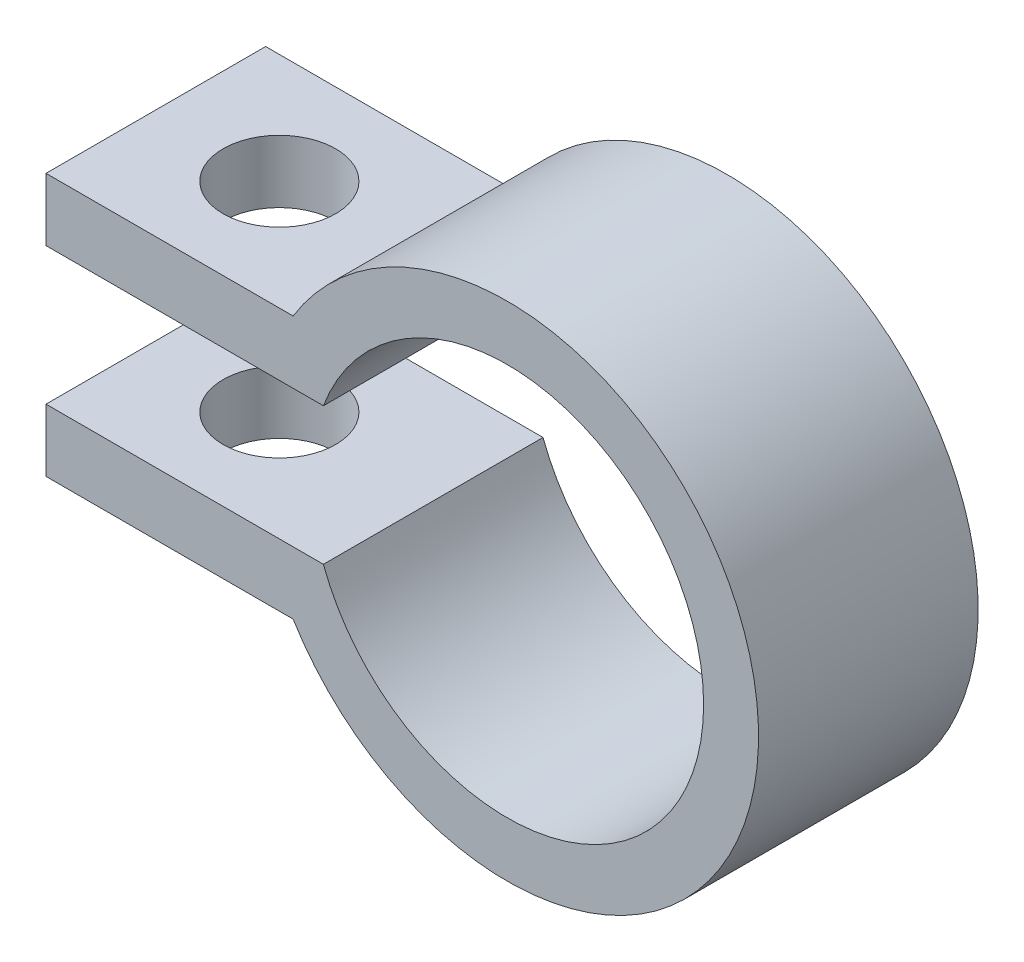
from build123d import *

# Parameters (mm, degrees)
BOSS_EXTRUDE1_DEPTH = 8
SKETCH3_R           = 2.05
CUT_EXTRUDE1_DEPTH  = 18.5


with BuildPart() as part:
    # Sketch1 → Boss-Extrude1 (new body)
    with BuildSketch(Plane.XY):
        with BuildLine():
            Line((-16.801846397, -4.780553608), (-7.801846397, -4.780553608))
            ThreePointArc((-7.801846397, -4.780553608), (9.15, 0), (-7.801846397, 4.780553608))
            Line((-7.801846397, 4.780553608), (-16.801846397, 4.780553608))
            Line((-16.801846397, 4.780553608), (-16.801846397, 2.5))
            Line((-16.801846397, 2.5), (-8.801846397, 2.5))
            Line((-8.801846397, 2.5), (-6.698693903, 2.5))
            ThreePointArc((-6.698693903, 2.5), (7.15, 0), (-6.698693903, -2.5))
            Line((-6.698693903, -2.5), (-8.801846397, -2.5))
            Line((-8.801846397, -2.5), (-16.801846397, -2.5))
            Line((-16.801846397, -2.5), (-16.801846397, -4.780553608))
        make_face()
    extrude(amount=BOSS_EXTRUDE1_DEPTH)

    # Sketch3 → Cut-Extrude1 (cut)
    with BuildSketch(Plane(origin=(0, 4.780553608, 0), x_dir=(1, 0, 0), z_dir=(0, 1, 0))):
        with Locations(Location((-12.301846397, -4, 0), (0, 0, 270))):
            Circle(SKETCH3_R)
    extrude(amount=-CUT_EXTRUDE1_DEPTH, mode=Mode.SUBTRACT)


solid = part.part
